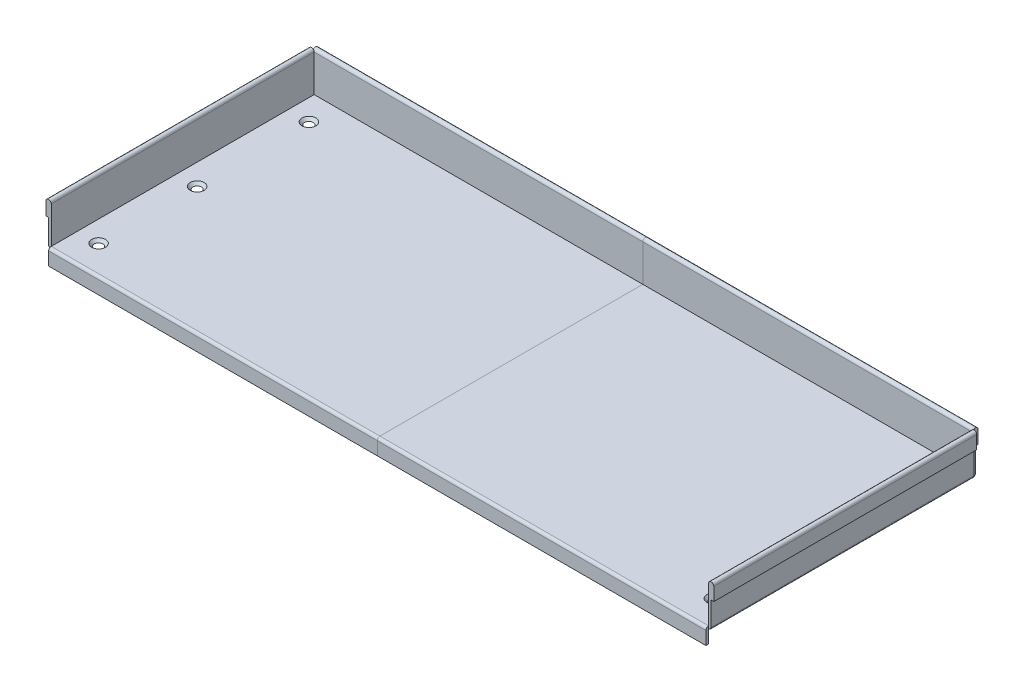
from build123d import *

# Parameters (mm, degrees)
EXTRUDE_1_DEPTH = 200
EXTRUDE_2_DEPTH = 251
EXTRUDE_3_DEPTH = 250


with BuildPart() as part:
    # 草圖1 → 擠出1 (new body)
    with BuildSketch(Plane.XY):
        with BuildLine():
            Line((0, 0), (0, -2))
            Line((0, -2), (250, -2))
            ThreePointArc((250, -2), (251.414213562, -1.414213562), (252, 0))
            Line((252, 0), (252, 18))
            Line((252, 18), (254, 18))
            Line((254, 18), (254, 28))
            ThreePointArc((254, 28), (253.414213562, 29.414213562), (252, 30))
            ThreePointArc((252, 30), (250.585786438, 29.414213562), (250, 28))
            Line((250, 28), (250, 0))
            Line((250, 0), (0, 0))
        make_face()
    extrude(amount=-EXTRUDE_1_DEPTH)

    # 草圖2 → 擠出2 (add)
    with BuildSketch(Plane.ZY):
        with BuildLine():
            Line((-200, -2), (-200, 28))
            ThreePointArc((-200, 28), (-200.585786438, 29.414213562), (-202, 30))
            ThreePointArc((-202, 30), (-203.414213562, 29.414213562), (-204, 28))
            Line((-204, 28), (-204, 18))
            Line((-204, 18), (-202, 18))
            Line((-202, 18), (-202, 0))
            ThreePointArc((-202, 0), (-201.414213562, -1.414213562), (-200, -2))
        make_face()
    extrude(amount=-EXTRUDE_2_DEPTH)

    # 草圖3 → 擠出3 (add)
    with BuildSketch(Plane.ZY):
        with BuildLine():
            Line((0, 0), (0, -12))
            Line((0, -12), (2, -12))
            Line((2, -12), (2, -2))
            ThreePointArc((2, -2), (1.414213562, -0.585786438), (0, 0))
        make_face()
    extrude(amount=-EXTRUDE_3_DEPTH)

    # 草圖4 → 迴轉1 (revolve, cut)
    with BuildSketch(Plane(origin=(234, 0, -200), x_dir=(0, 0, 1), z_dir=(-1, 0, 0)), mode=Mode.PRIVATE) as cut_revolve_1_sk:
        Polygon((180, 0), (180, -2), (176.75, -2), (174.75, 0), align=None)
    revolve(cut_revolve_1_sk.sketch.rotate(Axis((234, 0, -20), (0, -1, 0)), 180), axis=Axis((234, 0, -20), (0, -1, 0)), mode=Mode.SUBTRACT)

    # 草圖5 → 迴轉2 (revolve, cut)
    with BuildSketch(Plane(origin=(234, 0, -200), x_dir=(0, 0, 1), z_dir=(-1, 0, 0)), mode=Mode.PRIVATE) as cut_revolve_2_sk:
        Polygon((20, 0), (20, -2), (16.75, -2), (14.75, 0), align=None)
    revolve(cut_revolve_2_sk.sketch.rotate(Axis((234, 0, -180), (0, -1, 0)), 180), axis=Axis((234, 0, -180), (0, -1, 0)), mode=Mode.SUBTRACT)

    # 草圖6 → 迴轉3 (revolve, cut)
    with BuildSketch(Plane(origin=(234, 0, -200), x_dir=(0, 0, 1), z_dir=(-1, 0, 0)), mode=Mode.PRIVATE) as cut_revolve_3_sk:
        Polygon((105, 0), (105, -2), (101.75, -2), (99.75, 0), align=None)
    revolve(cut_revolve_3_sk.sketch.rotate(Axis((234, 0, -95), (0, -1, 0)), 180), axis=Axis((234, 0, -95), (0, -1, 0)), mode=Mode.SUBTRACT)


with BuildPart() as body_2:
    # 鏡射1: mirrored copy
    add(part.part.mirror(Plane(origin=(0, -1, -120), x_dir=(0, 0, 1), z_dir=(-1, 0, 0))))


solid = Compound([part.part, body_2.part])
